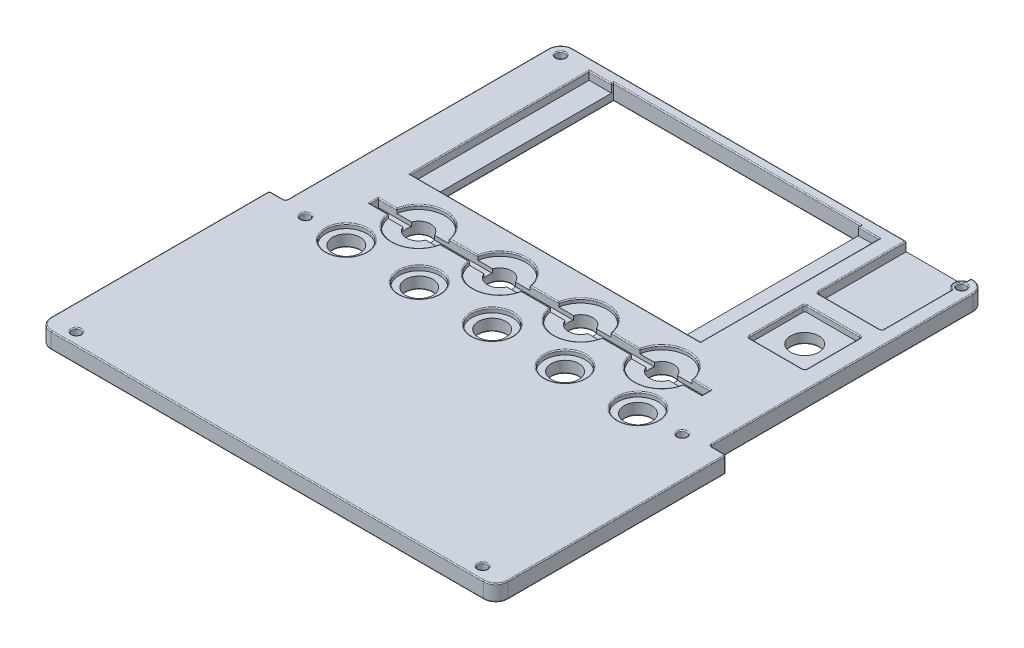
from build123d import *

# Parameters (mm, degrees)
MAIN_DEPTH                  = 4
DISPLAY_PCB_NOTCH_W         = 71.6
DISPLAY_PCB_NOTCH_H         = 44.1
PCB_NOTCH_DEPTH             = 2
DISPLAY_CUT_REACH           = 170.27
SKETCH4_W                   = 60.96
SKETCH4_H                   = 43.7
ROTARY_HOLE_REACH           = 170.27
SKETCH5_R                   = 3.5
MOUNTS_REACH                = 170.27
SKETCH6_R                   = 1.1
FILLET1_R                   = 3
TOGGLE_MOUNTS_REACH         = 170.27
SKETCH7_R                   = 3
SKETCH8_W                   = 82
SKETCH8_H                   = 2.1
TOGGLE_DIRECTION_DEPTH      = 2
SKETCH9_R                   = 6.5
TOGGLE_COUNTERSINKS_DEPTH   = 1
SKETCH10_W                  = 14
SKETCH10_H                  = 14
ENCODER_CLEARANCE_DEPTH     = 1.5
ENCODER_PIN_CLEARANCE_DEPTH = 2.3
FILLET2_R                   = 0.5
LED_MOUNTS_REACH            = 170.27
SKETCH12_R                  = 3.4
SKETCH13_R                  = 5
LED_COUNTERSINK_DEPTH       = 1.1
FILLET4_R                   = 0.25


with BuildPart() as part:
    # Sketch1 → Main (new body)
    with BuildSketch(Plane(origin=(0, 0, 0), x_dir=(1, 0, 0), z_dir=(0, 1, 0))):
        Polygon((112.8, 56.9), (108.8, 56.9), (108.8, 124.8), (4, 124.8), (4, 56.9), (0, 56.9), (0, 0), (112.8, 0), align=None)
    extrude(amount=MAIN_DEPTH)

    # Display PCB Notch → PCB Notch (cut)
    with BuildSketch(Plane.XZ.offset(-4)):
        with Locations((49.63, -99.97)):
            Rectangle(DISPLAY_PCB_NOTCH_W, DISPLAY_PCB_NOTCH_H)
    extrude(amount=PCB_NOTCH_DEPTH, mode=Mode.SUBTRACT)

    # Sketch4 → Display Cut (cut, up to next)
    with BuildSketch(Plane(origin=(0, 0, 0), x_dir=(-1, 0, 0), z_dir=(0, -1, 0)), mode=Mode.PRIVATE) as display_cut_sk1:
        with Locations((-49.81, 100.72)):
            Rectangle(SKETCH4_W, SKETCH4_H)
    display_cut_tool1 = extrude(display_cut_sk1.sketch, amount=-DISPLAY_CUT_REACH, mode=Mode.PRIVATE) & part.part
    add(display_cut_tool1.solids().sort_by_distance((49.81, 0, -100.72))[0], mode=Mode.SUBTRACT)

    # Sketch5 → Rotary Hole (cut, up to next)
    with BuildSketch(Plane.XZ, mode=Mode.PRIVATE) as rotary_hole_sk1:
        with Locations(Location((97.32, -91.75, 0), (0, 0, 270))):
            Circle(SKETCH5_R)
    rotary_hole_tool1 = extrude(rotary_hole_sk1.sketch, amount=-ROTARY_HOLE_REACH, mode=Mode.PRIVATE) & part.part
    add(rotary_hole_tool1.solids().sort_by_distance((97.32, 0, -91.75))[0], mode=Mode.SUBTRACT)

    # Sketch6 → Mounts (cut, up to next)
    with BuildSketch(Plane.XZ, mode=Mode.PRIVATE) as mounts_sk1:
        with Locations(Location((6.9, -121.9, 0), (0, 0, 270))):
            Circle(SKETCH6_R)
    mounts_tool1 = extrude(mounts_sk1.sketch, amount=-MOUNTS_REACH, mode=Mode.PRIVATE) & part.part
    # Sketch6 → Mounts (cut, up to next)
    with BuildSketch(Plane.XZ, mode=Mode.PRIVATE) as mounts_sk2:
        with Locations(Location((9.9, -55.9, 0), (0, 0, 270))):
            Circle(SKETCH6_R)
    mounts_tool2 = extrude(mounts_sk2.sketch, amount=-MOUNTS_REACH, mode=Mode.PRIVATE) & part.part
    # Sketch6 → Mounts (cut, up to next)
    with BuildSketch(Plane.XZ, mode=Mode.PRIVATE) as mounts_sk3:
        with Locations(Location((6.25, -3, 0), (0, 0, 270))):
            Circle(SKETCH6_R)
    mounts_tool3 = extrude(mounts_sk3.sketch, amount=-MOUNTS_REACH, mode=Mode.PRIVATE) & part.part
    # Sketch6 → Mounts (cut, up to next)
    with BuildSketch(Plane.XZ, mode=Mode.PRIVATE) as mounts_sk4:
        with Locations(Location((105.9, -121.9, 0), (0, 0, 90))):
            Circle(SKETCH6_R)
    mounts_tool4 = extrude(mounts_sk4.sketch, amount=-MOUNTS_REACH, mode=Mode.PRIVATE) & part.part
    # Sketch6 → Mounts (cut, up to next)
    with BuildSketch(Plane.XZ, mode=Mode.PRIVATE) as mounts_sk5:
        with Locations(Location((102.9, -55.9, 0), (0, 0, 90))):
            Circle(SKETCH6_R)
    mounts_tool5 = extrude(mounts_sk5.sketch, amount=-MOUNTS_REACH, mode=Mode.PRIVATE) & part.part
    # Sketch6 → Mounts (cut, up to next)
    with BuildSketch(Plane.XZ, mode=Mode.PRIVATE) as mounts_sk6:
        with Locations(Location((106.55, -3, 0), (0, 0, 90))):
            Circle(SKETCH6_R)
    mounts_tool6 = extrude(mounts_sk6.sketch, amount=-MOUNTS_REACH, mode=Mode.PRIVATE) & part.part
    add(mounts_tool1.solids().sort_by_distance((6.9, 0, -121.9))[0], mode=Mode.SUBTRACT)
    add(mounts_tool2.solids().sort_by_distance((9.9, 0, -55.9))[0], mode=Mode.SUBTRACT)
    add(mounts_tool3.solids().sort_by_distance((6.25, 0, -3))[0], mode=Mode.SUBTRACT)
    add(mounts_tool4.solids().sort_by_distance((105.9, 0, -121.9))[0], mode=Mode.SUBTRACT)
    add(mounts_tool5.solids().sort_by_distance((102.9, 0, -55.9))[0], mode=Mode.SUBTRACT)
    add(mounts_tool6.solids().sort_by_distance((106.55, 0, -3))[0], mode=Mode.SUBTRACT)

    # Fillet1
    fillet1_edges = [part.edges().sort_by_distance(p)[0] for p in [
        (4, 2, -124.8),
        (108.8, 2, -124.8),
        (112.8, 2, 0),
        (0, 2, 0),
    ]]
    fillet(fillet1_edges, radius=FILLET1_R)

    # Sketch7 → Toggle Mounts (cut, up to next)
    with BuildSketch(Plane.XZ, mode=Mode.PRIVATE) as toggle_mounts_sk1:
        with Locations(Location((26, -67.75, 0), (0, 0, 270))):
            Circle(SKETCH7_R)
    toggle_mounts_tool1 = extrude(toggle_mounts_sk1.sketch, amount=-TOGGLE_MOUNTS_REACH, mode=Mode.PRIVATE) & part.part
    # Sketch7 → Toggle Mounts (cut, up to next)
    with BuildSketch(Plane.XZ, mode=Mode.PRIVATE) as toggle_mounts_sk2:
        with Locations(Location((46, -67.75, 0), (0, 0, 270))):
            Circle(SKETCH7_R)
    toggle_mounts_tool2 = extrude(toggle_mounts_sk2.sketch, amount=-TOGGLE_MOUNTS_REACH, mode=Mode.PRIVATE) & part.part
    # Sketch7 → Toggle Mounts (cut, up to next)
    with BuildSketch(Plane.XZ, mode=Mode.PRIVATE) as toggle_mounts_sk3:
        with Locations(Location((66, -67.75, 0), (0, 0, 270))):
            Circle(SKETCH7_R)
    toggle_mounts_tool3 = extrude(toggle_mounts_sk3.sketch, amount=-TOGGLE_MOUNTS_REACH, mode=Mode.PRIVATE) & part.part
    # Sketch7 → Toggle Mounts (cut, up to next)
    with BuildSketch(Plane.XZ, mode=Mode.PRIVATE) as toggle_mounts_sk4:
        with Locations(Location((86, -67.75, 0), (0, 0, 270))):
            Circle(SKETCH7_R)
    toggle_mounts_tool4 = extrude(toggle_mounts_sk4.sketch, amount=-TOGGLE_MOUNTS_REACH, mode=Mode.PRIVATE) & part.part
    add(toggle_mounts_tool1.solids().sort_by_distance((26, 0, -67.75))[0], mode=Mode.SUBTRACT)
    add(toggle_mounts_tool2.solids().sort_by_distance((46, 0, -67.75))[0], mode=Mode.SUBTRACT)
    add(toggle_mounts_tool3.solids().sort_by_distance((66, 0, -67.75))[0], mode=Mode.SUBTRACT)
    add(toggle_mounts_tool4.solids().sort_by_distance((86, 0, -67.75))[0], mode=Mode.SUBTRACT)

    # Sketch8 → Toggle Direction (cut)
    with BuildSketch(Plane.XZ.offset(-4)):
        with Locations((56, -67.75)):
            Rectangle(SKETCH8_W, SKETCH8_H)
    extrude(amount=TOGGLE_DIRECTION_DEPTH, mode=Mode.SUBTRACT)

    # Sketch9 → Toggle Countersinks (cut)
    with BuildSketch(Plane(origin=(0, 4, 0), x_dir=(1, 0, 0), z_dir=(0, 1, 0))):
        with Locations((26, 67.75)):
            Circle(SKETCH9_R)
        with Locations((46, 67.75)):
            Circle(SKETCH9_R)
        with Locations((66, 67.75)):
            Circle(SKETCH9_R)
        with Locations((86, 67.75)):
            Circle(SKETCH9_R)
    extrude(amount=-TOGGLE_COUNTERSINKS_DEPTH, mode=Mode.SUBTRACT)

    # Sketch10 → Encoder Clearance (cut)
    with BuildSketch(Plane(origin=(0, 4, 0), x_dir=(1, 0, 0), z_dir=(0, 1, 0))):
        with Locations((97.32, 91.75)):
            Rectangle(SKETCH10_W, SKETCH10_H)
    extrude(amount=-ENCODER_CLEARANCE_DEPTH, mode=Mode.SUBTRACT)

    # Sketch11 → Encoder Pin Clearance (cut)
    with BuildSketch(Plane(origin=(0, 4, 0), x_dir=(1, 0, 0), z_dir=(0, 1, 0))):
        with BuildLine():
            Line((89.32, 102.75), (105.32, 102.75))
            Line((105.32, 102.75), (105.32, 120.09069074))
            ThreePointArc((105.32, 120.09069074), (104, 121.9), (105.32, 123.70930926))
            Line((105.32, 123.70930926), (105.32, 124.8))
            Line((105.32, 124.8), (89.32, 124.8))
            Line((89.32, 124.8), (89.32, 102.75))
        make_face()
    extrude(amount=-ENCODER_PIN_CLEARANCE_DEPTH, mode=Mode.SUBTRACT)

    # Fillet2
    fillet2_edges = [part.edges().sort_by_distance(p)[0] for p in [
        (0, 2, -56.9),
        (4, 2, -56.9),
        (108.8, 2, -56.9),
        (112.8, 2, -56.9),
        (104.32, 3.25, -98.75),
        (104.32, 3.25, -84.75),
        (90.32, 3.25, -84.75),
        (90.32, 3.25, -98.75),
        (89.32, 2.85, -102.75),
        (105.32, 2.85, -102.75),
    ]]
    fillet(fillet2_edges, radius=FILLET2_R)

    # Sketch12 → LED Mounts (cut, up to next)
    with BuildSketch(Plane(origin=(0, 4, 0), x_dir=(1, 0, 0), z_dir=(0, 1, 0)), mode=Mode.PRIVATE) as led_mounts_sk1:
        with Locations(Location((20, 55.9, 0), (0, 0, 270))):
            Circle(SKETCH12_R)
    led_mounts_tool1 = extrude(led_mounts_sk1.sketch, amount=-LED_MOUNTS_REACH, mode=Mode.PRIVATE) & part.part
    # Sketch12 → LED Mounts (cut, up to next)
    with BuildSketch(Plane(origin=(0, 4, 0), x_dir=(1, 0, 0), z_dir=(0, 1, 0)), mode=Mode.PRIVATE) as led_mounts_sk2:
        with Locations(Location((38, 55.9, 0), (0, 0, 270))):
            Circle(SKETCH12_R)
    led_mounts_tool2 = extrude(led_mounts_sk2.sketch, amount=-LED_MOUNTS_REACH, mode=Mode.PRIVATE) & part.part
    # Sketch12 → LED Mounts (cut, up to next)
    with BuildSketch(Plane(origin=(0, 4, 0), x_dir=(1, 0, 0), z_dir=(0, 1, 0)), mode=Mode.PRIVATE) as led_mounts_sk3:
        with Locations(Location((56, 55.9, 0), (0, 0, 270))):
            Circle(SKETCH12_R)
    led_mounts_tool3 = extrude(led_mounts_sk3.sketch, amount=-LED_MOUNTS_REACH, mode=Mode.PRIVATE) & part.part
    # Sketch12 → LED Mounts (cut, up to next)
    with BuildSketch(Plane(origin=(0, 4, 0), x_dir=(1, 0, 0), z_dir=(0, 1, 0)), mode=Mode.PRIVATE) as led_mounts_sk4:
        with Locations(Location((74, 55.9, 0), (0, 0, 270))):
            Circle(SKETCH12_R)
    led_mounts_tool4 = extrude(led_mounts_sk4.sketch, amount=-LED_MOUNTS_REACH, mode=Mode.PRIVATE) & part.part
    # Sketch12 → LED Mounts (cut, up to next)
    with BuildSketch(Plane(origin=(0, 4, 0), x_dir=(1, 0, 0), z_dir=(0, 1, 0)), mode=Mode.PRIVATE) as led_mounts_sk5:
        with Locations(Location((92, 55.9, 0), (0, 0, 270))):
            Circle(SKETCH12_R)
    led_mounts_tool5 = extrude(led_mounts_sk5.sketch, amount=-LED_MOUNTS_REACH, mode=Mode.PRIVATE) & part.part
    add(led_mounts_tool1.solids().sort_by_distance((20, 4, -55.9))[0], mode=Mode.SUBTRACT)
    add(led_mounts_tool2.solids().sort_by_distance((38, 4, -55.9))[0], mode=Mode.SUBTRACT)
    add(led_mounts_tool3.solids().sort_by_distance((56, 4, -55.9))[0], mode=Mode.SUBTRACT)
    add(led_mounts_tool4.solids().sort_by_distance((74, 4, -55.9))[0], mode=Mode.SUBTRACT)
    add(led_mounts_tool5.solids().sort_by_distance((92, 4, -55.9))[0], mode=Mode.SUBTRACT)

    # Sketch13 → LED Countersink (cut)
    with BuildSketch(Plane(origin=(0, 4, 0), x_dir=(1, 0, 0), z_dir=(0, 1, 0))):
        with Locations(Location((20, 55.9, 0), (0, 0, 270))):
            Circle(SKETCH13_R)
        with Locations(Location((38, 55.9, 0), (0, 0, 270))):
            Circle(SKETCH13_R)
        with Locations(Location((56, 55.9, 0), (0, 0, 270))):
            Circle(SKETCH13_R)
        with Locations(Location((74, 55.9, 0), (0, 0, 270))):
            Circle(SKETCH13_R)
        with Locations(Location((92, 55.9, 0), (0, 0, 270))):
            Circle(SKETCH13_R)
    extrude(amount=-LED_COUNTERSINK_DEPTH, mode=Mode.SUBTRACT)

    # Fillet4
    fillet4_edges = [part.edges().sort_by_distance(p)[0] for p in [
        (111.921320344, 4, -0.878679656),
        (26, 0, -64.75),
        (46, 0, -64.75),
        (66, 0, -64.75),
        (86, 0, -64.75),
        (94.707315856, 4, -66.7),
        (17.292684144, 4, -68.8),
        (97, 4, -67.75),
        (15, 4, -67.75),
        (94.707315856, 4, -68.8),
        (76, 4, -66.7),
        (76, 4, -68.8),
        (56, 4, -66.7),
        (56, 4, -68.8),
        (17.292684144, 4, -66.7),
        (36, 4, -66.7),
        (36, 4, -68.8),
        (26, 4, -74.25),
        (26, 4, -61.25),
        (46, 4, -74.25),
        (46, 4, -61.25),
        (66, 4, -74.25),
        (66, 4, -61.25),
        (86, 4, -61.25),
        (86, 4, -74.25),
        (13.83, 4, -99.97),
        (16.58, 4, -122.02),
        (85.43, 4, -99.97),
        (49.63, 4, -77.92),
        (48.16, 4, -124.8),
        (89.32, 4, -114.025),
        (104, 4, -121.9),
        (105.32, 4, -124.25465463),
        (97.32, 4, -102.75),
        (105.32, 4, -111.67034537),
        (104.32, 4, -91.75),
        (97.32, 4, -84.75),
        (97.32, 4, -98.75),
        (90.32, 4, -91.75),
        (0, 0, -29.7),
        (0, 4, -29.7),
        (2, 0, -56.9),
        (108.8, 0, -89.6),
        (110.8, 0, -56.9),
        (112.653553391, 0, -56.753553391),
        (0.146446609, 0, -56.753553391),
        (2, 4, -56.9),
        (110.8, 4, -56.9),
        (108.8, 4, -89.6),
        (112.653553391, 4, -56.753553391),
        (0.146446609, 4, -56.753553391),
        (89.466446609, 4, -102.896446609),
        (105.173553391, 4, -102.896446609),
        (104.173553391, 4, -84.896446609),
        (104.173553391, 4, -98.603553391),
        (90.466446609, 4, -98.603553391),
        (90.466446609, 4, -84.896446609),
        (3.853553391, 0, -57.046446609),
        (3.853553391, 4, -57.046446609),
        (108.946446609, 0, -57.046446609),
        (108.946446609, 4, -57.046446609),
        (92, 0, -59.3),
        (82.86, 4, -122.02),
        (20, 0, -59.3),
        (38, 0, -59.3),
        (56, 0, -59.3),
        (74, 0, -59.3),
        (20, 4, -60.9),
        (38, 4, -60.9),
        (56, 4, -60.9),
        (74, 4, -60.9),
        (92, 4, -60.9),
        (19.33, 4, -122.295),
        (80.29, 4, -122.295),
        (49.81, 4, -122.57),
        (19.33, 0, -100.72),
        (49.81, 0, -122.57),
        (80.29, 0, -100.72),
        (49.81, 0, -78.87),
        (97.32, 0, -88.25),
        (105.9, 0, -123),
        (105.9, 4, -123),
        (102.9, 0, -57),
        (102.9, 4, -57),
        (106.55, 0, -4.1),
        (106.55, 4, -4.1),
        (6.25, 4, -1.9),
        (6.25, 0, -1.9),
        (9.9, 4, -54.8),
        (9.9, 0, -54.8),
        (6.9, 4, -120.8),
        (6.9, 0, -120.8),
        (112.8, 0, -29.7),
        (112.8, 4, -29.7),
        (4, 0, -89.6),
        (56.4, 0, -124.8),
        (56.4, 0, 0),
        (0.878679656, 0, -0.878679656),
        (4.878679656, 0, -123.921320344),
        (107.921320344, 0, -123.921320344),
        (111.921320344, 0, -0.878679656),
        (56.4, 4, 0),
        (105.56, 4, -124.8),
        (4, 4, -89.6),
        (0.878679656, 4, -0.878679656),
        (4.878679656, 4, -123.921320344),
        (107.921320344, 4, -123.921320344),
    ]]
    fillet(fillet4_edges, radius=FILLET4_R)


solid = part.part
